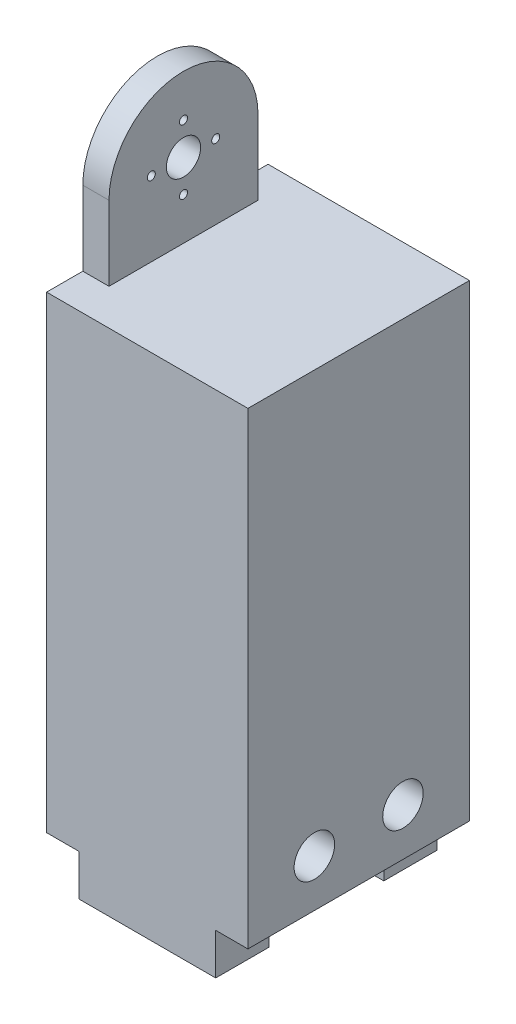
from build123d import *

# Parameters (mm, degrees)
SKETCH1_W               = 50
SKETCH1_H               = 150
BOSS_EXTRUDE1_DEPTH     = 55
CUT_EXTRUDE1_DEPTH      = 168.406690428
CUT_EXTRUDE1_DEPTH_BACK = 45
SKETCH2_R               = 10.25
SKETCH7_R               = 1
SKETCH7_R_2             = 4.25
CUT_EXTRUDE3_DEPTH      = 10
SKETCH8_W               = 55
SKETCH8_H               = 55
SKETCH8_R               = 10.25
BOSS_EXTRUDE2_DEPTH     = 50
SKETCH10_W              = 8
SKETCH10_H              = 10.25
SKETCH10_W_2            = 17
SKETCH10_H_2            = 1
SKETCH10_W_3            = 34
SKETCH10_H_3            = 20
SKETCH10_H_4            = 5
CUT_EXTRUDE4_DEPTH      = 214.717102732
SKETCH11_W              = 34
SKETCH11_H              = 13.25
BOSS_EXTRUDE4_DEPTH     = 25
SKETCH13_W              = 55
SKETCH13_H              = 10
CUT_EXTRUDE5_DEPTH      = 8
SKETCH14_R              = 5.030159043
CUT_EXTRUDE6_DEPTH      = 8
SKETCH15_W              = 34
SKETCH15_H              = 0.25
BOSS_EXTRUDE5_DEPTH     = 13.25
CUT_EXTRUDE7_DEPTH      = 181.416185527
BOSS_EXTRUDE6_START     = 1.5
SKETCH19_R              = 10.25
SKETCH19_R_2            = 1
SKETCH19_R_3            = 4.25
BOSS_EXTRUDE6_DEPTH     = 1.5
CUT_EXTRUDE8_DEPTH      = 184.89467094


with BuildPart() as part:
    # Sketch1 → Boss-Extrude1 (new body)
    with BuildSketch(Plane.XY):
        with Locations((0, -75)):
            Rectangle(SKETCH1_W, SKETCH1_H)
    extrude(amount=-BOSS_EXTRUDE1_DEPTH)

    # Sketch2 → Cut-Extrude1 (cut, two sides: drawn at the far end of the back side and taken through both)
    with BuildSketch(Plane(origin=(25, 0, 0), x_dir=(0, 0, -1), z_dir=(1, 0, 0)).offset(-CUT_EXTRUDE1_DEPTH_BACK)):
        with Locations(Location((27.5, -25, 0), (0, 0, 270))):
            Circle(SKETCH2_R)
    extrude(amount=CUT_EXTRUDE1_DEPTH + CUT_EXTRUDE1_DEPTH_BACK, mode=Mode.SUBTRACT)

    # Sketch7 → Cut-Extrude3 (cut)
    with BuildSketch(Plane(origin=(-20, 0, 0), x_dir=(0, 0, -1), z_dir=(1, 0, 0))):
        with Locations(Location((27.5, -17, 0), (0, 0, 90))):
            Circle(SKETCH7_R)
        with Locations(Location((35.5, -25, 0), (0, 0, 90))):
            Circle(SKETCH7_R)
        with Locations(Location((27.5, -33, 0), (0, 0, 90))):
            Circle(SKETCH7_R)
        with Locations(Location((19.5, -25, 0), (0, 0, 90))):
            Circle(SKETCH7_R)
        with Locations(Location((27.5, -25, 0), (0, 0, 90))):
            Circle(SKETCH7_R_2)
    extrude(amount=-CUT_EXTRUDE3_DEPTH, mode=Mode.SUBTRACT)

    # Sketch8 → Boss-Extrude2 (add)
    with BuildSketch(Plane(origin=(25, 0, 0), x_dir=(0, 0, -1), z_dir=(1, 0, 0))):
        with Locations((27.5, -177.5)):
            Rectangle(SKETCH8_W, SKETCH8_H)
        with Locations(Location((27.5, -180, 0), (0, 0, 90))):
            Circle(SKETCH8_R, mode=Mode.SUBTRACT)
    extrude(amount=-BOSS_EXTRUDE2_DEPTH)

    # Sketch10 → Cut-Extrude4 (cut, through all)
    with BuildSketch(Plane.XY):
        Polygon((-17, -205), (17, -205), (17, -191.25), (0, -191.25), (-17, -191.25), align=None)
        Polygon((-25, -205), (-17, -205), (-17, -191.25), (-17, -190.25), (-25, -190.25), align=None)
        Polygon((17, -191.25), (17, -205), (25, -205), (25, -190.25), (17, -190.25), align=None)
        with Locations((-21, -185.125)):
            Rectangle(SKETCH10_W, SKETCH10_H)
        with Locations((-21, -174.875)):
            Rectangle(SKETCH10_W, SKETCH10_H)
        with Locations((21, -174.875)):
            Rectangle(SKETCH10_W, SKETCH10_H)
        with Locations((21, -185.125)):
            Rectangle(SKETCH10_W, SKETCH10_H)
        with Locations((-8.5, -185.125)):
            Rectangle(SKETCH10_W_2, SKETCH10_H)
        with Locations((8.5, -185.125)):
            Rectangle(SKETCH10_W_2, SKETCH10_H)
        Polygon((0, -180), (17, -180), (17, -169.75), (-17, -169.75), (-17, -180), align=None)
        with Locations((-8.5, -190.75)):
            Rectangle(SKETCH10_W_2, SKETCH10_H_2)
        with Locations((8.5, -190.75)):
            Rectangle(SKETCH10_W_2, SKETCH10_H_2)
        with Locations((0, -154.75)):
            Rectangle(SKETCH10_W_3, SKETCH10_H_3)
        with Locations((0, -167.25)):
            Rectangle(SKETCH10_W_3, SKETCH10_H_4)
    extrude(amount=-CUT_EXTRUDE4_DEPTH, mode=Mode.SUBTRACT)

    # Sketch11 → Boss-Extrude4 (add)
    with BuildSketch(Plane.XZ.offset(144.75)):
        with Locations((0, -6.625)):
            Rectangle(SKETCH11_W, SKETCH11_H)
        with Locations((0, -48.375)):
            Rectangle(SKETCH11_W, SKETCH11_H)
    extrude(amount=BOSS_EXTRUDE4_DEPTH)

    # Sketch13 → Cut-Extrude5 (cut)
    with BuildSketch(Plane(origin=(25, 0, 0), x_dir=(0, 0, -1), z_dir=(1, 0, 0))):
        with Locations((27.5, -164.75)):
            Rectangle(SKETCH13_W, SKETCH13_H)
    cut_extrude5 = extrude(amount=-CUT_EXTRUDE5_DEPTH, mode=Mode.SUBTRACT)

    # Mirror2: Cut-Extrude5 across plane
    add(cut_extrude5.mirror(Plane(origin=(0, 0, 0), x_dir=(0, 0, 1), z_dir=(1, 0, 0))), mode=Mode.SUBTRACT)

    # Sketch14 → Cut-Extrude6 (cut)
    with BuildSketch(Plane(origin=(25, 0, 0), x_dir=(0, 0, -1), z_dir=(1, 0, 0))):
        with Locations(Location((16.5, -148, 0), (0, 0, 90))):
            Circle(SKETCH14_R)
        with Locations(Location((38.5, -148, 0), (0, 0, 90))):
            Circle(SKETCH14_R)
    cut_extrude6 = extrude(amount=-CUT_EXTRUDE6_DEPTH, mode=Mode.SUBTRACT)

    # Mirror3: Cut-Extrude6 across plane
    add(cut_extrude6.mirror(Plane(origin=(0, 0, 0), x_dir=(0, 0, 1), z_dir=(1, 0, 0))), mode=Mode.SUBTRACT)

    # Sketch15 → Boss-Extrude5 (add)
    with BuildSketch(Plane.XY):
        with Locations((0, -169.875)):
            Rectangle(SKETCH15_W, SKETCH15_H)
    boss_extrude5 = extrude(amount=-BOSS_EXTRUDE5_DEPTH)

    # Mirror4: Boss-Extrude5 across plane
    add(boss_extrude5.mirror(Plane.XY.offset(-27.5)))

    # Sketch16 → Cut-Extrude7 (cut, through all)
    with BuildSketch(Plane.XY):
        Polygon((-18.5, 0), (-18.5, -14.75), (-18.5, -35.25), (-18.5, -43.5), (25, -43.5), (25, 0), align=None)
    extrude(amount=-CUT_EXTRUDE7_DEPTH, mode=Mode.SUBTRACT)

    # Sketch19 → Boss-Extrude6 (add)
    with BuildSketch(Plane(origin=(-20, 0, 0), x_dir=(0, 0, -1), z_dir=(1, 0, 0)).offset(BOSS_EXTRUDE6_START)):
        with Locations((27.5, -25)):
            Circle(SKETCH19_R)
        with Locations(Location((27.5, -17, 0), (0, 0, 90))):
            Circle(SKETCH19_R_2, mode=Mode.SUBTRACT)
        with Locations(Location((27.5, -33, 0), (0, 0, 90))):
            Circle(SKETCH19_R_2, mode=Mode.SUBTRACT)
        with Locations(Location((19.5, -25, 0), (0, 0, 90))):
            Circle(SKETCH19_R_2, mode=Mode.SUBTRACT)
        with Locations(Location((35.5, -25, 0), (0, 0, 90))):
            Circle(SKETCH19_R_2, mode=Mode.SUBTRACT)
        with Locations(Location((27.5, -25, 0), (0, 0, 90))):
            Circle(SKETCH19_R_3, mode=Mode.SUBTRACT)
    extrude(amount=-BOSS_EXTRUDE6_DEPTH)

    # Sketch20 → Cut-Extrude8 (cut, through all)
    with BuildSketch(Plane(origin=(-18.5, 0, 0), x_dir=(0, 0, -1), z_dir=(1, 0, 0))):
        with BuildLine():
            Line((0, 0), (0, -43.5))
            Line((0, -43.5), (9, -43.5))
            Line((9, -43.5), (9, -25))
            ThreePointArc((9, -25), (27.5, -6.5), (46, -25))
            Line((46, -25), (46, -43.5))
            Line((46, -43.5), (55, -43.5))
            Line((55, -43.5), (55, 0))
            Line((55, 0), (0, 0))
        make_face()
    extrude(amount=-CUT_EXTRUDE8_DEPTH, mode=Mode.SUBTRACT)


solid = part.part
